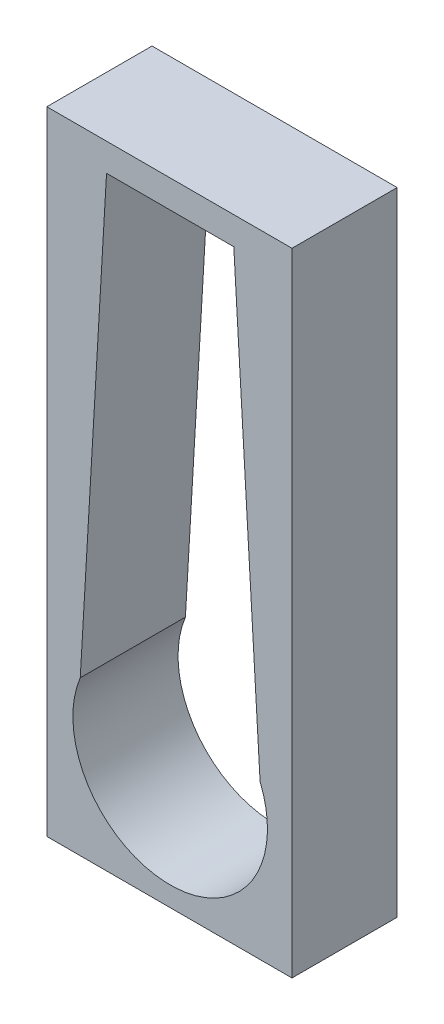
from build123d import *

# Parameters (mm, degrees)
SKETCH2_W           = 9.323493139
SKETCH2_H           = 24.035794238
BOSS_EXTRUDE1_DEPTH = 4


with BuildPart() as part:
    # Sketch2 → Boss-Extrude1 (new body)
    with BuildSketch(Plane.XY):
        with Locations((-0.028670292, 7.569333036)):
            Rectangle(SKETCH2_W, SKETCH2_H)
        with BuildLine():
            Line((2.42, 18.53), (-2.42, 18.53))
            Line((-2.42, 18.53), (-3.42, 1.411949008))
            ThreePointArc((-3.42, 1.411949008), (0, -3.7), (3.42, 1.411949008))
            Line((3.42, 1.411949008), (2.42, 18.53))
        make_face(mode=Mode.SUBTRACT)
    extrude(amount=BOSS_EXTRUDE1_DEPTH)


solid = part.part
